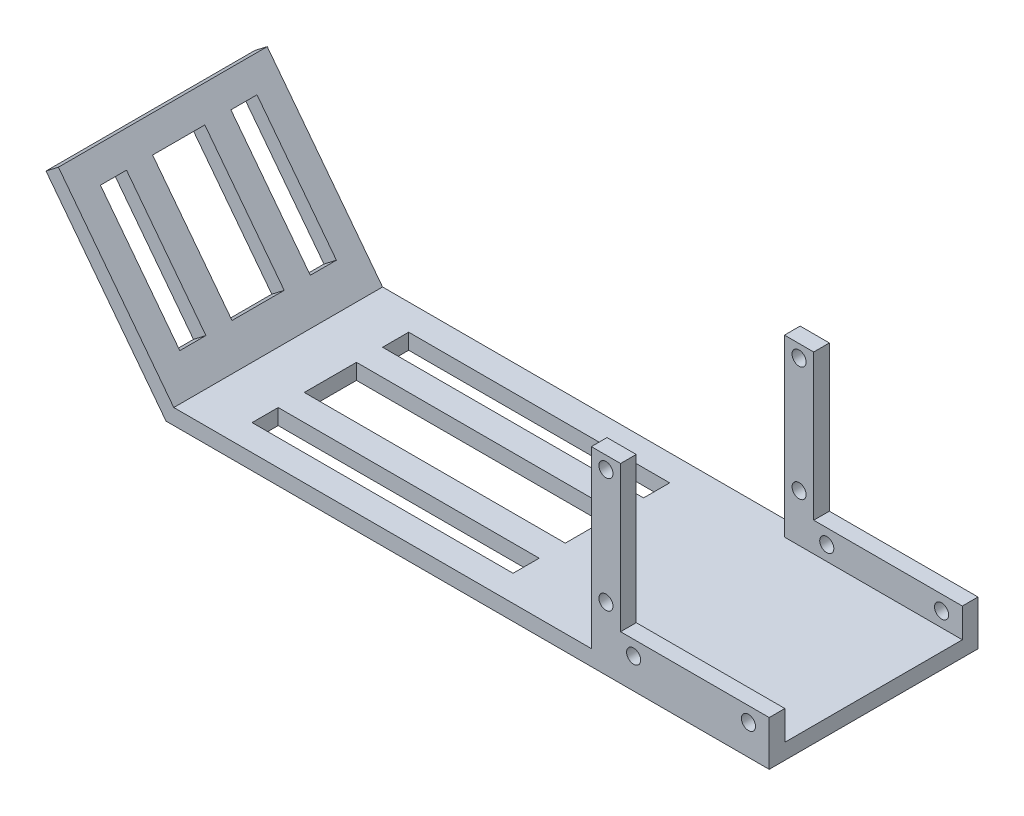
from build123d import *

# Parameters (mm, degrees)
BOSS_EXTRUDE1_DEPTH = 34
BOSS_EXTRUDE4_START = -34
SKETCH2_R           = 1.35
BOSS_EXTRUDE4_DEPTH = 3
BOSS_EXTRUDE5_START = 3
SKETCH3_R           = 1.35
BOSS_EXTRUDE5_DEPTH = 3
CUT_EXTRUDE1_REACH  = 149.269
SKETCH4_W           = 50
SKETCH4_H           = 5
SKETCH4_H_2         = 10
CUT_EXTRUDE3_REACH  = 122.462
SKETCH5_W           = 5
SKETCH5_H           = 25


with BuildPart() as part:
    # Sketch1 → Boss-Extrude1 (new body)
    with BuildSketch(Plane.XY):
        Polygon((-115.55, 0), (0, 0), (0, 3), (-114.069788366, 3), (-136.169180916, 31.825294631), (-138.55, 30), align=None)
    extrude(amount=BOSS_EXTRUDE1_DEPTH)

    # Sketch2 → Boss-Extrude4 (add)
    # profile 1 of 3: a face of its own
    with BuildSketch(Plane.XY.offset(34).offset(BOSS_EXTRUDE4_START)):
        Polygon((0, 3), (-114.069788366, 3), (-136.169180916, 31.825294631), (-138.55, 30), (-115.55, 0), (0, 0), align=None)
    # profile 2 of 3: a face of its own
    with BuildSketch(Plane.XY.offset(34).offset(BOSS_EXTRUDE4_START)):
        Polygon((-34.075, 36.51210805), (-34.075, 3), (0, 3), (0, 8.6), (-28.475, 8.6), (-28.475, 36.51210805), align=None)
        with Locations((-25.975, 5.8)):
            Circle(SKETCH2_R, mode=Mode.SUBTRACT)
        with Locations((-3.975, 5.8)):
            Circle(SKETCH2_R, mode=Mode.SUBTRACT)
        with Locations((-31.275, 12.1)):
            Circle(SKETCH2_R, mode=Mode.SUBTRACT)
        with Locations((-31.275, 34.1)):
            Circle(SKETCH2_R, mode=Mode.SUBTRACT)
    # profile 3 of 3: a face of its own
    with BuildSketch(Plane.XY.offset(34).offset(BOSS_EXTRUDE4_START)):
        Polygon((-104.069788366, 3), (-114.069788366, 3), (-136.169180916, 31.825294631), (-138.55, 30), (-115.55, 0), (0, 0), (0, 3), (-34.075, 3), (-100.504119084, 3), align=None)
    extrude(amount=-BOSS_EXTRUDE4_DEPTH)

    # Sketch3 → Boss-Extrude5 (add)
    with BuildSketch(Plane.XY.offset(34).offset(BOSS_EXTRUDE5_START)):
        Polygon((0, 0), (0, 3), (0, 8.6), (-28.475, 8.6), (-28.475, 36.51210805), (-34.075, 36.51210805), (-34.075, 3), (-114.069788366, 3), (-136.169180916, 31.825294631), (-138.55, 30), (-115.55, 0), align=None)
        with Locations((-31.275, 34.1)):
            Circle(SKETCH3_R, mode=Mode.SUBTRACT)
        with Locations((-31.275, 12.1)):
            Circle(SKETCH3_R, mode=Mode.SUBTRACT)
        with Locations((-25.975, 5.8)):
            Circle(SKETCH3_R, mode=Mode.SUBTRACT)
        with Locations((-3.975, 5.8)):
            Circle(SKETCH3_R, mode=Mode.SUBTRACT)
    extrude(amount=-BOSS_EXTRUDE5_DEPTH)

    # Sketch4 → Cut-Extrude1 (cut, up to next)
    with BuildSketch(Plane(origin=(0, 3, 0), x_dir=(1, 0, 0), z_dir=(0, 1, 0)), mode=Mode.PRIVATE) as cut_extrude1_sk1:
        with Locations((-79.069788366, -4.5)):
            Rectangle(SKETCH4_W, SKETCH4_H)
    cut_extrude1_tool1 = extrude(cut_extrude1_sk1.sketch, amount=-CUT_EXTRUDE1_REACH, mode=Mode.PRIVATE) & part.part
    # Sketch4 → Cut-Extrude1 (cut, up to next)
    with BuildSketch(Plane(origin=(0, 3, 0), x_dir=(1, 0, 0), z_dir=(0, 1, 0)), mode=Mode.PRIVATE) as cut_extrude1_sk2:
        with Locations((-79.069788366, -29.5)):
            Rectangle(SKETCH4_W, SKETCH4_H)
    cut_extrude1_tool2 = extrude(cut_extrude1_sk2.sketch, amount=-CUT_EXTRUDE1_REACH, mode=Mode.PRIVATE) & part.part
    # Sketch4 → Cut-Extrude1 (cut, up to next)
    with BuildSketch(Plane(origin=(0, 3, 0), x_dir=(1, 0, 0), z_dir=(0, 1, 0)), mode=Mode.PRIVATE) as cut_extrude1_sk3:
        with Locations((-79.069788366, -17)):
            Rectangle(SKETCH4_W, SKETCH4_H_2)
    cut_extrude1_tool3 = extrude(cut_extrude1_sk3.sketch, amount=-CUT_EXTRUDE1_REACH, mode=Mode.PRIVATE) & part.part
    add(cut_extrude1_tool1.solids().sort_by_distance((-79.069788, 3, 4.5))[0], mode=Mode.SUBTRACT)
    add(cut_extrude1_tool2.solids().sort_by_distance((-79.069788, 3, 29.5))[0], mode=Mode.SUBTRACT)
    add(cut_extrude1_tool3.solids().sort_by_distance((-79.069788, 3, 17))[0], mode=Mode.SUBTRACT)

    # Sketch5 → Cut-Extrude3 (cut, up to next)
    with BuildSketch(Plane(origin=(-70.393848516, -53.968617195, 0), x_dir=(0, 0, -1), z_dir=(0.7936063612919156, 0.6084315436571361, 0)), mode=Mode.PRIVATE) as cut_extrude3_sk1:
        with Locations((-19.5, 90.606381212)):
            Rectangle(SKETCH5_W, SKETCH5_H)
    cut_extrude3_tool1 = extrude(cut_extrude3_sk1.sketch, amount=-CUT_EXTRUDE3_REACH, mode=Mode.PRIVATE) & part.part
    # Sketch5 → Cut-Extrude3 (cut, up to next)
    with BuildSketch(Plane(origin=(-70.393848516, -53.968617195, 0), x_dir=(0, 0, -1), z_dir=(0.7936063612919156, 0.6084315436571361, 0)), mode=Mode.PRIVATE) as cut_extrude3_sk2:
        with Locations((-14.5, 90.606381212)):
            Rectangle(SKETCH5_W, SKETCH5_H)
    cut_extrude3_tool2 = extrude(cut_extrude3_sk2.sketch, amount=-CUT_EXTRUDE3_REACH, mode=Mode.PRIVATE) & part.part
    # Sketch5 → Cut-Extrude3 (cut, up to next)
    with BuildSketch(Plane(origin=(-70.393848516, -53.968617195, 0), x_dir=(0, 0, -1), z_dir=(0.7936063612919156, 0.6084315436571361, 0)), mode=Mode.PRIVATE) as cut_extrude3_sk3:
        with Locations((-4.5, 90.606381212)):
            Rectangle(SKETCH5_W, SKETCH5_H)
    cut_extrude3_tool3 = extrude(cut_extrude3_sk3.sketch, amount=-CUT_EXTRUDE3_REACH, mode=Mode.PRIVATE) & part.part
    # Sketch5 → Cut-Extrude3 (cut, up to next)
    with BuildSketch(Plane(origin=(-70.393848516, -53.968617195, 0), x_dir=(0, 0, -1), z_dir=(0.7936063612919156, 0.6084315436571361, 0)), mode=Mode.PRIVATE) as cut_extrude3_sk4:
        with Locations((-29.5, 90.606381212)):
            Rectangle(SKETCH5_W, SKETCH5_H)
    cut_extrude3_tool4 = extrude(cut_extrude3_sk4.sketch, amount=-CUT_EXTRUDE3_REACH, mode=Mode.PRIVATE) & part.part
    add(cut_extrude3_tool1.solids().sort_by_distance((-125.521629, 17.937183, 19.5))[0], mode=Mode.SUBTRACT)
    add(cut_extrude3_tool2.solids().sort_by_distance((-125.521629, 17.937183, 14.5))[0], mode=Mode.SUBTRACT)
    add(cut_extrude3_tool3.solids().sort_by_distance((-125.521629, 17.937183, 4.5))[0], mode=Mode.SUBTRACT)
    add(cut_extrude3_tool4.solids().sort_by_distance((-125.521629, 17.937183, 29.5))[0], mode=Mode.SUBTRACT)


solid = part.part
